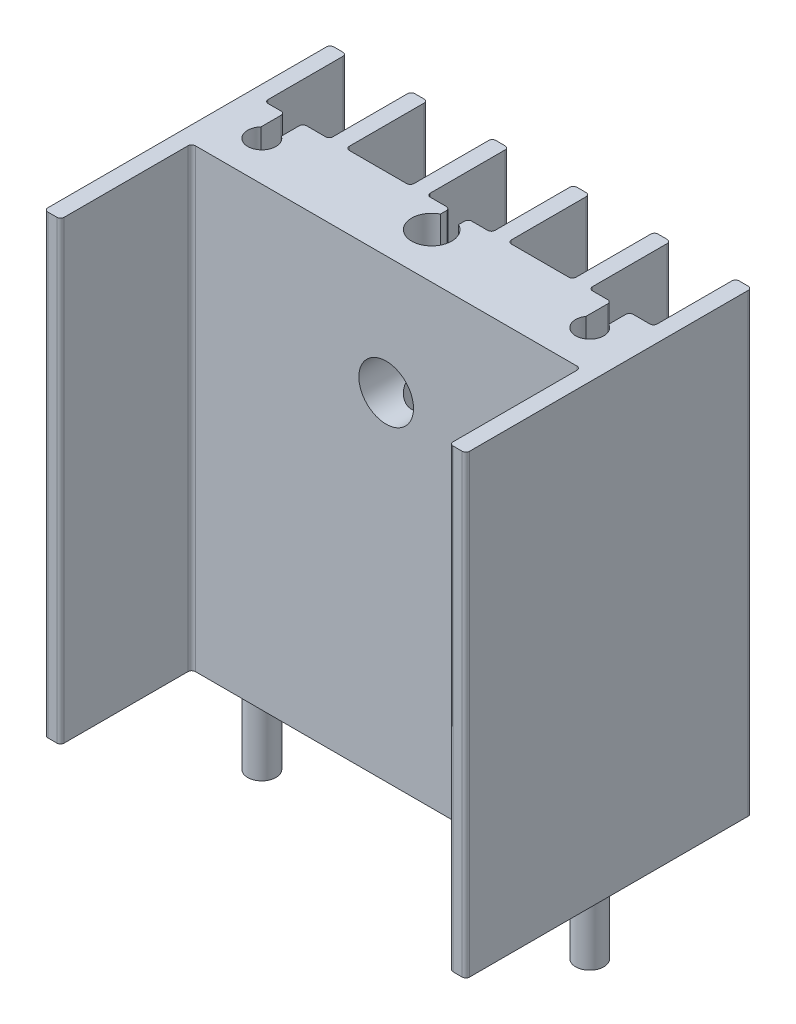
from build123d import *

# Parameters (mm, degrees)
EXTRUDE_1_DEPTH      = 25
EXTRUDE_2_DEPTH      = 5
EXTRUDE_2_DEPTH_BACK = 20
SKETCH_2_R           = 0.775
FILLET_1_R           = 0.2
SKETCH_3_R           = 1.5
CUT_EXTRUDE_1_DEPTH  = 10


with BuildPart() as part:
    # 草图1 → 凸台-拉伸1 (new body)
    with BuildSketch(Plane(origin=(0, 0, 0), x_dir=(1, 0, 0), z_dir=(0, 1, 0))):
        with BuildLine():
            Line((-11.375, -7.85), (-10.875, -7.85))
            ThreePointArc((-10.875, -7.85), (-10.733578644, -7.791421356), (-10.675, -7.65))
            Line((-10.675, -7.65), (-10.675, -0.65))
            Line((-10.675, -0.65), (10.675, -0.65))
            Line((10.675, -0.65), (10.675, -7.65))
            ThreePointArc((10.675, -7.65), (10.733578644, -7.791421356), (10.875, -7.85))
            Line((10.875, -7.85), (11.375, -7.85))
            ThreePointArc((11.375, -7.85), (11.516421356, -7.791421356), (11.575, -7.65))
            Line((11.575, -7.65), (11.575, 7.65))
            ThreePointArc((11.575, 7.65), (11.516421356, 7.791421356), (11.375, 7.85))
            Line((11.375, 7.85), (10.875, 7.85))
            ThreePointArc((10.875, 7.85), (10.733578644, 7.791421356), (10.675, 7.65))
            Line((10.675, 7.65), (10.675, 3.55))
            ThreePointArc((10.675, 3.55), (10.616421356, 3.408578644), (10.475, 3.35))
            Line((10.475, 3.35), (9.558099354, 3.35))
            ThreePointArc((9.558099354, 3.35), (9.416677998, 3.291421356), (9.358099354, 3.15))
            Line((9.358099354, 3.15), (9.358099354, 2.212306229))
            ThreePointArc((9.358099354, 2.212306229), (9.190112859, 0.773679762), (8.358099354, 1.959267845))
            Line((8.358099354, 1.959267845), (8.358099354, 3.15))
            ThreePointArc((8.358099354, 3.15), (8.29952071, 3.291421356), (8.158099354, 3.35))
            Line((8.158099354, 3.35), (7.325, 3.35))
            ThreePointArc((7.325, 3.35), (7.183578644, 3.408578644), (7.125, 3.55))
            Line((7.125, 3.55), (7.125, 7.65))
            ThreePointArc((7.125, 7.65), (7.066421356, 7.791421356), (6.925, 7.85))
            Line((6.925, 7.85), (6.425, 7.85))
            ThreePointArc((6.425, 7.85), (6.283578644, 7.791421356), (6.225, 7.65))
            Line((6.225, 7.65), (6.225, 3.55))
            ThreePointArc((6.225, 3.55), (6.166421356, 3.408578644), (6.025, 3.35))
            Line((6.025, 3.35), (2.875, 3.35))
            ThreePointArc((2.875, 3.35), (2.733578644, 3.408578644), (2.675, 3.55))
            Line((2.675, 3.55), (2.675, 7.65))
            ThreePointArc((2.675, 7.65), (2.616421356, 7.791421356), (2.475, 7.85))
            Line((2.475, 7.85), (1.975, 7.85))
            ThreePointArc((1.975, 7.85), (1.833578644, 7.791421356), (1.775, 7.65))
            Line((1.775, 7.65), (1.775, 3.55))
            ThreePointArc((1.775, 3.55), (1.716421356, 3.408578644), (1.575, 3.35))
            Line((1.575, 3.35), (0.7, 3.35))
            ThreePointArc((0.7, 3.35), (0.558578644, 3.291421356), (0.5, 3.15))
            Line((0.5, 3.15), (0.5, 2.829795897))
            ThreePointArc((0.5, 2.829795897), (0, 0.75), (-0.5, 2.829795897))
            Line((-0.5, 2.829795897), (-0.5, 3.15))
            ThreePointArc((-0.5, 3.15), (-0.558578644, 3.291421356), (-0.7, 3.35))
            Line((-0.7, 3.35), (-1.575, 3.35))
            ThreePointArc((-1.575, 3.35), (-1.716421356, 3.408578644), (-1.775, 3.55))
            Line((-1.775, 3.55), (-1.775, 7.65))
            ThreePointArc((-1.775, 7.65), (-1.833578644, 7.791421356), (-1.975, 7.85))
            Line((-1.975, 7.85), (-2.475, 7.85))
            ThreePointArc((-2.475, 7.85), (-2.616421356, 7.791421356), (-2.675, 7.65))
            Line((-2.675, 7.65), (-2.675, 3.55))
            ThreePointArc((-2.675, 3.55), (-2.733578644, 3.408578644), (-2.875, 3.35))
            Line((-2.875, 3.35), (-6.025, 3.35))
            ThreePointArc((-6.025, 3.35), (-6.166421356, 3.408578644), (-6.225, 3.55))
            Line((-6.225, 3.55), (-6.225, 7.65))
            ThreePointArc((-6.225, 7.65), (-6.283578644, 7.791421356), (-6.425, 7.85))
            Line((-6.425, 7.85), (-6.925, 7.85))
            ThreePointArc((-6.925, 7.85), (-7.066421356, 7.791421356), (-7.125, 7.65))
            Line((-7.125, 7.65), (-7.125, 3.55))
            ThreePointArc((-7.125, 3.55), (-7.183578644, 3.408578644), (-7.325, 3.35))
            Line((-7.325, 3.35), (-8.37016684, 3.35))
            ThreePointArc((-8.37016684, 3.35), (-8.511588196, 3.291421356), (-8.57016684, 3.15))
            Line((-8.57016684, 3.15), (-8.57016684, 2.169878635))
            ThreePointArc((-8.57016684, 2.169878635), (-8.907689329, 0.755517226), (-9.57016684, 2.049914064))
            Line((-9.57016684, 2.049914064), (-9.57016684, 3.15))
            ThreePointArc((-9.57016684, 3.15), (-9.628745484, 3.291421356), (-9.77016684, 3.35))
            Line((-9.77016684, 3.35), (-10.475, 3.35))
            ThreePointArc((-10.475, 3.35), (-10.616421356, 3.408578644), (-10.675, 3.55))
            Line((-10.675, 3.55), (-10.675, 7.65))
            ThreePointArc((-10.675, 7.65), (-10.733578644, 7.791421356), (-10.875, 7.85))
            Line((-10.875, 7.85), (-11.375, 7.85))
            ThreePointArc((-11.375, 7.85), (-11.516421356, 7.791421356), (-11.575, 7.65))
            Line((-11.575, 7.65), (-11.575, -7.65))
            ThreePointArc((-11.575, -7.65), (-11.516421356, -7.791421356), (-11.375, -7.85))
        make_face()
    extrude(amount=EXTRUDE_1_DEPTH)

    # 草图2 → 凸台-拉伸2 (add, two sides: drawn at the far end of the back side and taken through both)
    with BuildSketch(Plane.XZ.offset(-EXTRUDE_2_DEPTH_BACK)):
        with Locations(Location((-9, -1.525, 0), (0, 0, 270))):
            Circle(SKETCH_2_R)
        with Locations(Location((9, -1.525, 0), (0, 0, 270))):
            Circle(SKETCH_2_R)
    extrude(amount=EXTRUDE_2_DEPTH + EXTRUDE_2_DEPTH_BACK)

    # 圆角1
    fillet_1_edges = [part.edges().sort_by_distance(p)[0] for p in [
        (-10.675, 12.5, 0.65),
        (10.675, 12.5, 0.65),
    ]]
    fillet(fillet_1_edges, radius=FILLET_1_R)

    # 草图3 → 切除-拉伸1 (cut)
    with BuildSketch(Plane.XY.offset(0.65)):
        with Locations((0, 18.5)):
            Circle(SKETCH_3_R)
    extrude(amount=-CUT_EXTRUDE_1_DEPTH, mode=Mode.SUBTRACT)


solid = part.part
